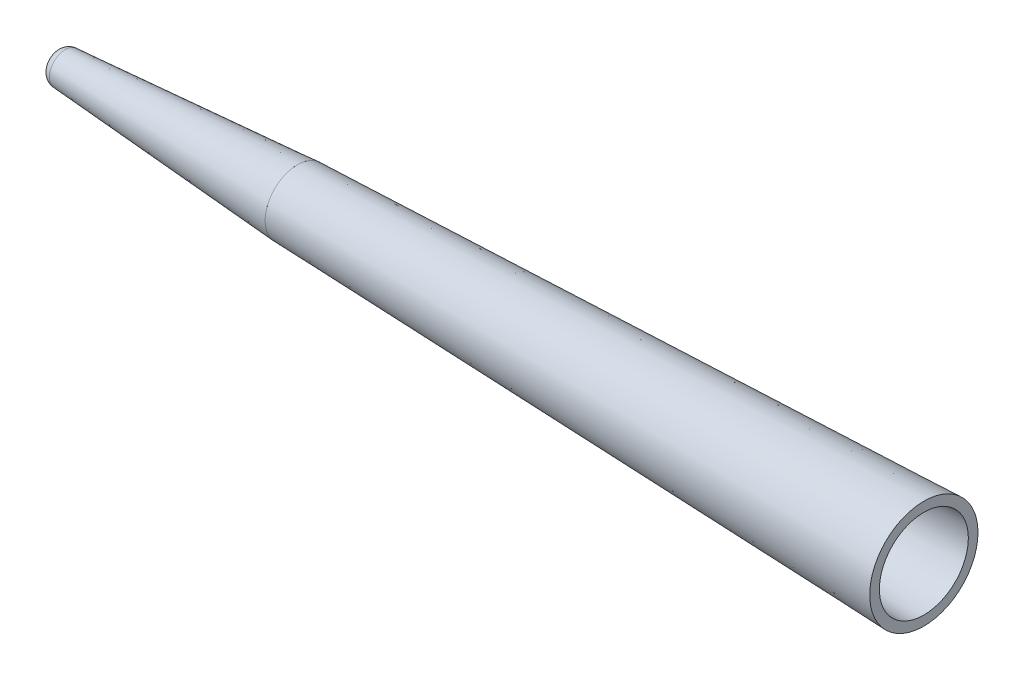
from build123d import *


with BuildPart() as part:
    # Sketch2 → Revolve2 (revolve)
    with BuildSketch(Plane.XY, mode=Mode.PRIVATE) as revolve2_sk:
        with BuildLine():
            Line((0, 1.2), (50, 4.696340597))
            Line((50, 4.696340597), (50, 6.696340597))
            Line((50, 6.696340597), (1.851094968, 3.32944117))
            ThreePointArc((1.851094968, 3.32944117), (0.484525778, 2.648094905), (0, 1.2))
        make_face()
    revolve(revolve2_sk.sketch.rotate(Axis((-19.275847123, 0, 0), (1, 0, 0)), 90), axis=Axis((-19.275847123, 0, 0), (1, 0, 0)))


with BuildPart() as body_2:
    # Sketch3 → Revolve3 (revolve)
    with BuildSketch(Plane.XY, mode=Mode.PRIVATE) as revolve3_sk:
        Polygon((50, 4.695121509), (180, 9.234821543), (180, 11.236040631), (50, 6.696340597), align=None)
    revolve(revolve3_sk.sketch.rotate(Axis((50, 0, 0), (-1, 0, 0)), 90), axis=Axis((50, 0, 0), (-1, 0, 0)))


solid = Compound([part.part, body_2.part])
